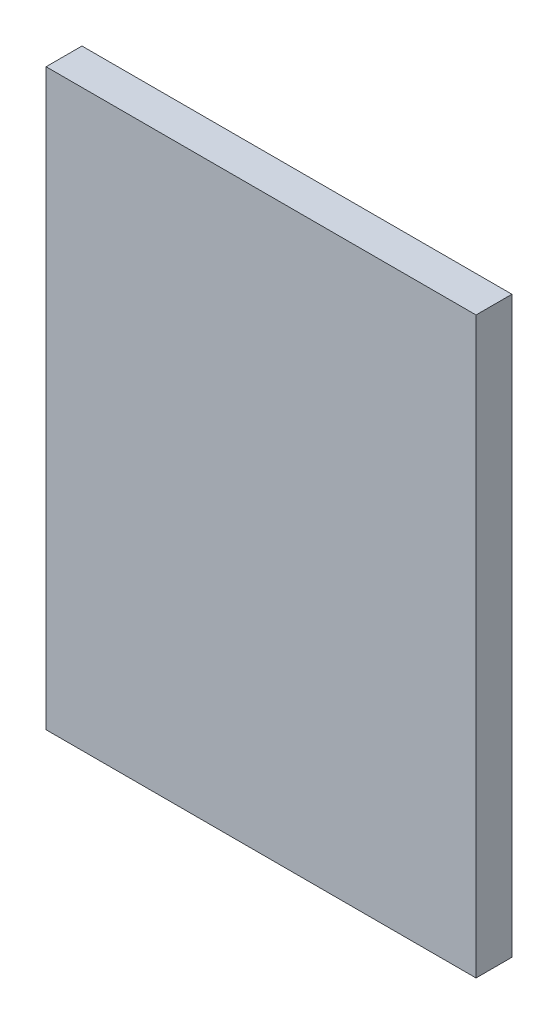
from build123d import *

# Parameters (mm, degrees)
SKETCH1_W           = 76.07554
SKETCH1_H           = 101.6
BOSS_EXTRUDE1_DEPTH = 6.35


with BuildPart() as part:
    # Sketch1 → Boss-Extrude1 (new body)
    with BuildSketch(Plane.XY):
        Rectangle(SKETCH1_W, SKETCH1_H)
    extrude(amount=BOSS_EXTRUDE1_DEPTH)


solid = part.part
